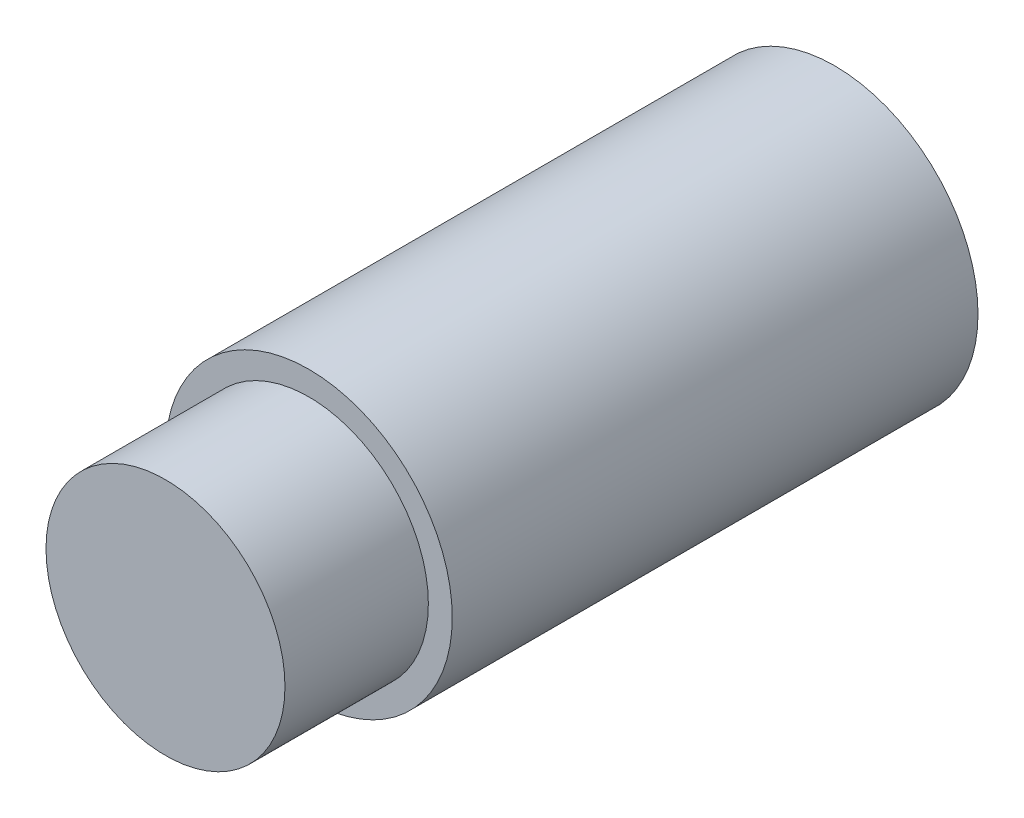
from build123d import *

# Parameters (mm, degrees)
SCHIZZO1_R                   = 3
ESTRUSIONE_ESTRUSIONE1_DEPTH = 11
SCHIZZO2_R                   = 2.5
ESTRUSIONE_ESTRUSIONE2_DEPTH = 3


with BuildPart() as part:
    # Schizzo1 → Estrusione-Estrusione1 (new body)
    with BuildSketch(Plane.XY):
        Circle(SCHIZZO1_R)
    extrude(amount=ESTRUSIONE_ESTRUSIONE1_DEPTH)

    # Schizzo2 → Estrusione-Estrusione2 (add)
    with BuildSketch(Plane.XY.offset(11)):
        Circle(SCHIZZO2_R)
    extrude(amount=ESTRUSIONE_ESTRUSIONE2_DEPTH)


solid = part.part
